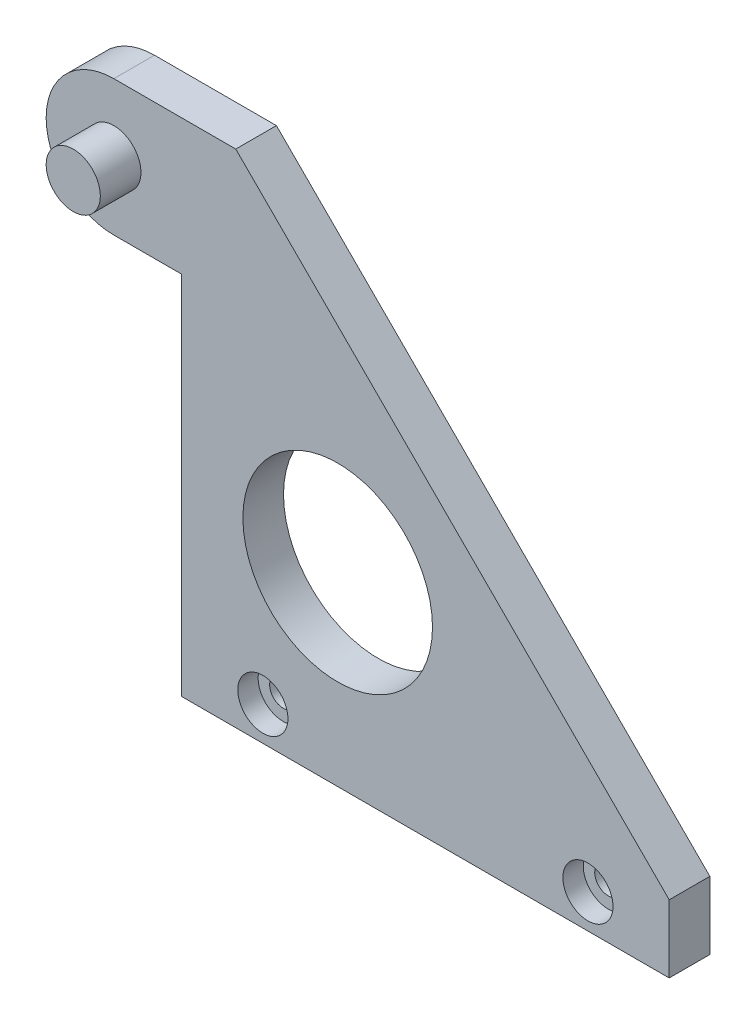
from build123d import *

# Parameters (mm, degrees)
EXTRUDE_1_DEPTH     = 3
SKETCH_3_R          = 7
CUT_EXTRUDE_1_DEPTH = 47.49731175
SKETCH_4_R          = 1
CUT_EXTRUDE_2_DEPTH = 47.49731175
SKETCH_5_R          = 2
EXTRUDE_2_DEPTH     = 3
FILLET_1_RADIUS     = 5
FILLET_1_LENGTH     = 3
SKETCH_6_R          = 1.85
CUT_EXTRUDE_3_DEPTH = 1.5


with BuildPart() as part:
    # 草图1 → 凸台-拉伸1 (new body)
    with BuildSketch(Plane.XY):
        Polygon((-18, 0), (18, 0), (18, 5), (-14, 37), (-28, 37), (-28, 27), (-18, 27), align=None)
    extrude(amount=EXTRUDE_1_DEPTH)

    # 草图3 → 切除-拉伸1 (cut, through all)
    with BuildSketch(Plane.XY.offset(3)):
        with Locations((-6.476357534, 13.687539211)):
            Circle(SKETCH_3_R)
    extrude(amount=-CUT_EXTRUDE_1_DEPTH, mode=Mode.SUBTRACT)

    # 草图4 → 切除-拉伸2 (cut, through all)
    with BuildSketch(Plane.XY.offset(3)):
        with Locations((12, 2.5)):
            Circle(SKETCH_4_R)
        with Locations(Location((-12, 2.5, 0), (0, 0, 180))):
            Circle(SKETCH_4_R)
    extrude(amount=-CUT_EXTRUDE_2_DEPTH, mode=Mode.SUBTRACT)

    # 草图5 → 凸台-拉伸2 (add)
    with BuildSketch(Plane.XY.offset(3)):
        with Locations(Location((-23, 32, 0), (0, 0, 180))):
            Circle(SKETCH_5_R)
    extrude(amount=EXTRUDE_2_DEPTH)

    # 圆角1: full round fillet: the end face becomes a half cylinder, R = half its width
    fillet_1_face = Plane((-28, 32, 1.5), x_dir=(0, 0, 1), z_dir=(-1, 0, 0))  # on the end face: x along it, z out of the body
    fillet_1_slab = fillet_1_face.offset(-FILLET_1_RADIUS / 2) * Box(FILLET_1_LENGTH, 2 * FILLET_1_RADIUS, FILLET_1_RADIUS, mode=Mode.PRIVATE)  # the body's end, R deep
    fillet_1_round = Plane((-23, 32, 1.5), x_dir=(-1, 0, 0), z_dir=(0, 0, 1)) * Cylinder(FILLET_1_RADIUS, FILLET_1_LENGTH, mode=Mode.PRIVATE)  # its axis R under the face
    add(fillet_1_slab - fillet_1_round, mode=Mode.SUBTRACT)

    # 草图6 → 切除-拉伸3 (cut)
    with BuildSketch(Plane.XY.offset(3)):
        with Locations((12, 2.5)):
            Circle(SKETCH_6_R)
        with Locations((-12, 2.5)):
            Circle(SKETCH_6_R)
    extrude(amount=-CUT_EXTRUDE_3_DEPTH, mode=Mode.SUBTRACT)


solid = part.part
